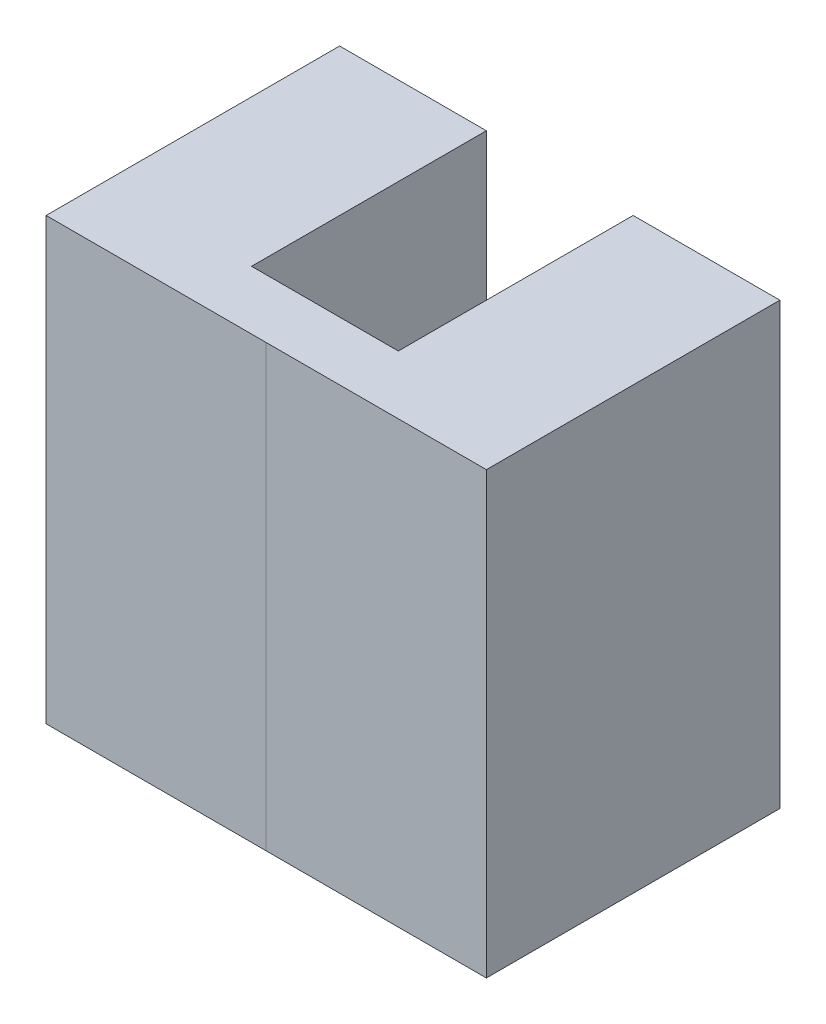
from build123d import *

# Parameters (mm, degrees)
SKETCH1_W           = 3
SKETCH1_H           = 3
BOSS_EXTRUDE1_DEPTH = 2
SKETCH2_W           = 1
SKETCH2_H           = 1.6
CUT_EXTRUDE1_DEPTH  = 5.69041576


with BuildPart() as part:
    # Sketch1 → Boss-Extrude1 (new body)
    with BuildSketch(Plane.XY):
        with Locations((1.5, 1.5)):
            Rectangle(SKETCH1_W, SKETCH1_H)
    extrude(amount=BOSS_EXTRUDE1_DEPTH)

    # Sketch2 → Cut-Extrude1 (cut, through all)
    with BuildSketch(Plane.XZ):
        with Locations((1.5, 0.8)):
            Rectangle(SKETCH2_W, SKETCH2_H)
    extrude(amount=-CUT_EXTRUDE1_DEPTH, mode=Mode.SUBTRACT)


solid = part.part
